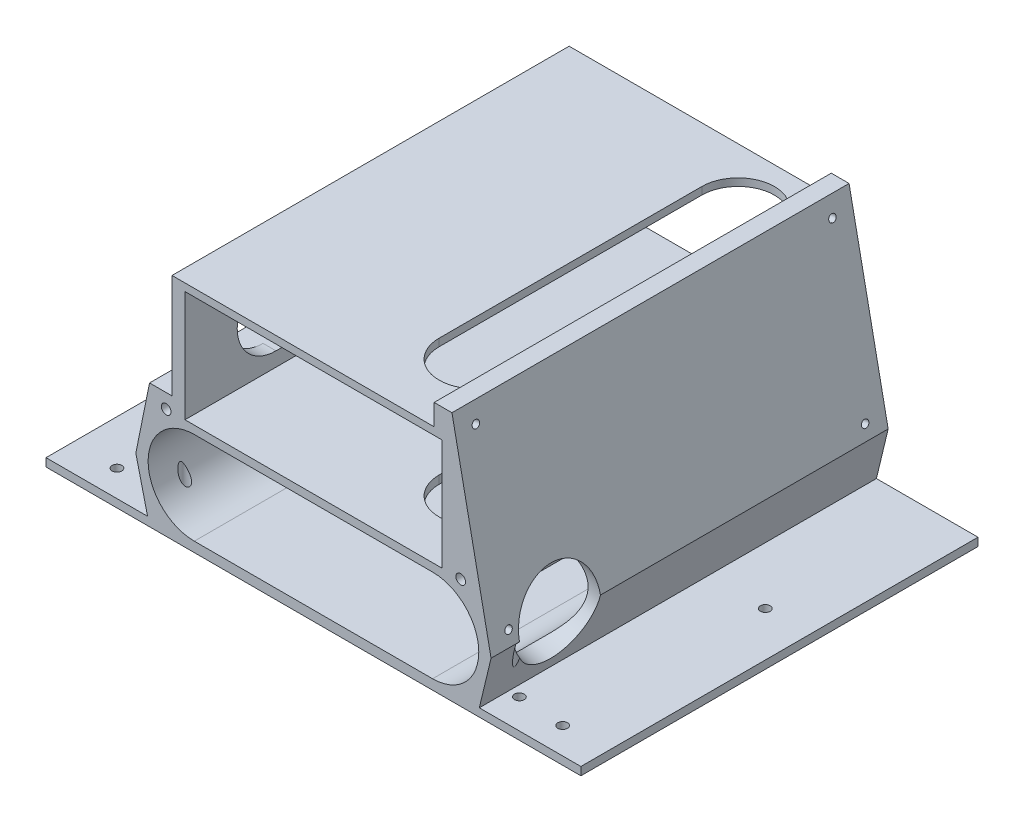
from build123d import *

# Parameters (mm, degrees)
ESQUISSE1_W              = 112.172532808
ESQUISSE1_H              = 92.061088164
BOSS_EXTRU_1_DEPTH       = 98
ESQUISSE2_W              = 63.4
ESQUISSE2_H              = 27.4
ENL_V_MAT_EXTRU_1_DEPTH  = 122.93637795
ENL_V_MAT_EXTRU_2_DEPTH  = 122.93637795
ESQUISSE8_R              = 1.2
ENL_V_MAT_EXTRU_5_DEPTH  = 122.93637795
ENL_V_MAT_EXTRU_10_DEPTH = 36
BOSS_EXTRU_2_DEPTH       = 98
ESQUISSE15_R             = 0.9
ENL_V_MAT_EXTRU_11_DEPTH = 5
ENL_V_MAT_EXTRU_13_DEPTH = 33
ESQUISSE18_R             = 10
ENL_V_MAT_EXTRU_14_DEPTH = 7
ESQUISSE19_W             = 80.9
ESQUISSE19_H             = 35.571792003
ENL_V_MAT_EXTRU_15_DEPTH = 119.955890106
BOSS_EXTRU_3_DEPTH       = 2
ESQUISSE22_R             = 1.2
ENL_V_MAT_EXTRU_16_DEPTH = 14


with BuildPart() as part:
    # Esquisse1 → Boss.-Extru.1 (new body)
    with BuildSketch(Plane.XY):
        Rectangle(ESQUISSE1_W, ESQUISSE1_H)
    extrude(amount=BOSS_EXTRU_1_DEPTH)

    # Esquisse2 → Enlèv. mat.-Extru.1 (cut, through all)
    with BuildSketch(Plane.XY.offset(98)):
        with Locations((0, 30.491247921)):
            Rectangle(ESQUISSE2_W, ESQUISSE2_H)
    extrude(amount=-ENL_V_MAT_EXTRU_1_DEPTH, mode=Mode.SUBTRACT)

    # Esquisse3 → Enlèv. mat.-Extru.2 (cut, through all)
    with BuildSketch(Plane.XY.offset(98)):
        with BuildLine():
            Line((-29.4, 14.791247921), (29.4, 14.791247921))
            ThreePointArc((29.4, 14.791247921), (40.8, 3.391247921), (29.4, -8.008752079))
            Line((29.4, -8.008752079), (-29.4, -8.008752079))
            ThreePointArc((-29.4, -8.008752079), (-40.8, 3.391247921), (-29.4, 14.791247921))
        make_face()
    extrude(amount=-ENL_V_MAT_EXTRU_2_DEPTH, mode=Mode.SUBTRACT)

    # Esquisse8 → Enlèv. mat.-Extru.5 (cut, through all)
    with BuildSketch(Plane(origin=(0, 0, 0), x_dir=(-1, 0, 0), z_dir=(0, 0, -1))):
        with Locations((36.342435472, 16.729092577)):
            Circle(ESQUISSE8_R)
        with Locations(Location((-36.342435472, 16.729092577, 0), (0, 0, 180))):
            Circle(ESQUISSE8_R)
        Polygon((40.45, -46.030544082), (40.45, -10.458752079), (43.831541667, 3.591247921), (40.45, 20.287049631), (34.90419829, 20.287049631), (34.90419829, 46.030544082), (56.086266404, 46.030544082), (56.086266404, -46.030544082), align=None)
        Polygon((-40.45, -46.030544082), (-40.45, -10.458752079), (-43.831541667, 3.591247921), (-40.45, 20.287049631), (-35.235952742, 46.030544082), (-56.086266404, 46.030544082), (-56.086266404, -46.030544082), align=None)
    extrude(amount=-ENL_V_MAT_EXTRU_5_DEPTH, mode=Mode.SUBTRACT)

    # Esquisse13 → Enlèv. mat.-Extru.10 (cut)
    with BuildSketch(Plane(origin=(0, 46.030544082, 0), x_dir=(1, 0, 0), z_dir=(0, 1, 0))):
        with BuildLine():
            Line((29.401511347, -13.631097944), (29.401511347, -78.444504203))
            ThreePointArc((29.401511347, -78.444504203), (20.430009822, -87.416005728), (11.458508297, -78.444504203))
            Line((11.458508297, -78.444504203), (11.458508297, -13.631097944))
            ThreePointArc((11.458508297, -13.631097944), (20.430009822, -4.659596419), (29.401511347, -13.631097944))
        make_face()
    extrude(amount=-ENL_V_MAT_EXTRU_10_DEPTH, mode=Mode.SUBTRACT)

    # Esquisse14 → Boss.-Extru.2 (add, through all)
    with BuildSketch(Plane(origin=(0, 0, 0), x_dir=(-1, 0, 0), z_dir=(0, 0, -1))):
        Polygon((-35.235952742, 46.030544082), (-34.181307811, 51.237678691), (-29.786849485, 51.237678691), (-29.786849485, 46.030544082), align=None)
    extrude(amount=-BOSS_EXTRU_2_DEPTH)

    # Esquisse15 → Enlèv. mat.-Extru.11 (cut)
    with BuildSketch(Plane(origin=(42.803048455, 8.669262748, 0), x_dir=(0, 0, -1), z_dir=(0.980099310455717, 0.19850778736419453, 0))):
        with Locations(Location((-5.012556966, -1.831122741, 0), (0, 0, 90))):
            Circle(ESQUISSE15_R)
        with Locations(Location((-5.012556966, 38.868877259, 0), (0, 0, 90))):
            Circle(ESQUISSE15_R)
        with Locations(Location((-93.012556966, -1.831122741, 0), (0, 0, 90))):
            Circle(ESQUISSE15_R)
        with Locations(Location((-93.012556966, 38.868877259, 0), (0, 0, 90))):
            Circle(ESQUISSE15_R)
    extrude(amount=-ENL_V_MAT_EXTRU_11_DEPTH, mode=Mode.SUBTRACT)

    # Esquisse17 → Enlèv. mat.-Extru.13 (cut)
    with BuildSketch(Plane.ZY.offset(34.90419829)):
        with BuildLine():
            Line((11.891222977, 39.441182616), (75.540539517, 39.441182616))
            ThreePointArc((75.540539517, 39.441182616), (85.11760601, 29.864116124), (75.540539517, 20.287049631))
            Line((75.540539517, 20.287049631), (11.891222977, 20.287049631))
            ThreePointArc((11.891222977, 20.287049631), (2.314156484, 29.864116124), (11.891222977, 39.441182616))
        make_face()
    extrude(amount=-ENL_V_MAT_EXTRU_13_DEPTH, mode=Mode.SUBTRACT)

    # Esquisse18 → Enlèv. mat.-Extru.14 (cut)
    with BuildSketch(Plane(origin=(40.614547147, -9.775073555, 0), x_dir=(0, 0, -1), z_dir=(0.9722372677043548, -0.23399721213461214, 0))):
        with Locations(Location((-81, 13.74800362, 0), (0, 0, 32.947816907))):
            Circle(ESQUISSE18_R)
    extrude(amount=-ENL_V_MAT_EXTRU_14_DEPTH, mode=Mode.SUBTRACT)

    # Esquisse19 → Enlèv. mat.-Extru.15 (cut, through all)
    with BuildSketch(Plane(origin=(0, 0, 0), x_dir=(-1, 0, 0), z_dir=(0, 0, -1))):
        with Locations((0, -28.244648081)):
            Rectangle(ESQUISSE19_W, ESQUISSE19_H)
    extrude(amount=-ENL_V_MAT_EXTRU_15_DEPTH, mode=Mode.SUBTRACT)

    # Esquisse21 → Boss.-Extru.3 (add)
    with BuildSketch(Plane.XZ.offset(10.458752079)):
        Polygon((-40.45, 98), (40.45, 98), (66, 98), (66, 0), (40.45, 0), (-40.45, 0), (-66, 0), (-66, 98), align=None)
    extrude(amount=-BOSS_EXTRU_3_DEPTH)

    # Esquisse22 → Enlèv. mat.-Extru.16 (cut)
    with BuildSketch(Plane.XZ.offset(10.458752079)):
        with Locations(Location((43.537561985, 90.712580413, 0), (0, 0, 270))):
            Circle(ESQUISSE22_R)
        with Locations(Location((55, 91.492580413, 0), (0, 0, 270))):
            Circle(ESQUISSE22_R)
        with Locations(Location((37.317561985, 42.512580413, 0), (0, 0, 270))):
            Circle(ESQUISSE22_R)
        with Locations(Location((55, 41.492580413, 0), (0, 0, 270))):
            Circle(ESQUISSE22_R)
        with Locations(Location((-55, 41.492580413, 0), (0, 0, 270))):
            Circle(ESQUISSE22_R)
        with Locations(Location((-37.922438015, 42.512580413, 0), (0, 0, 270))):
            Circle(ESQUISSE22_R)
        with Locations(Location((-55, 91.492580413, 0), (0, 0, 270))):
            Circle(ESQUISSE22_R)
        with Locations(Location((-39.065455989, 90.712580413, 0), (0, 0, 270))):
            Circle(ESQUISSE22_R)
    extrude(amount=-ENL_V_MAT_EXTRU_16_DEPTH, mode=Mode.SUBTRACT)


solid = part.part
